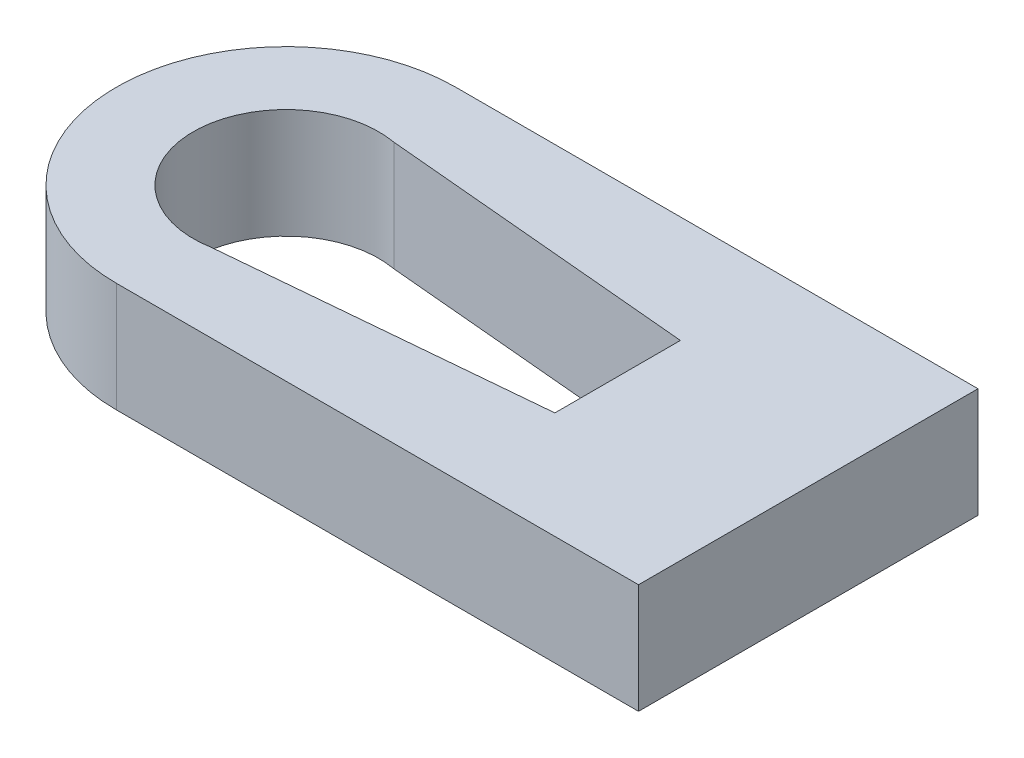
from build123d import *

# Parameters (mm, degrees)
BOSS_EXTRUDE1_START = 21.4
SKETCH1_R           = 6.5
BOSS_EXTRUDE1_DEPTH = 2.1
BOSS_EXTRUDE2_START = 21.4
SKETCH2_W           = 20
SKETCH2_H           = 13
BOSS_EXTRUDE2_DEPTH = 2.1
CUT_EXTRUDE1_START  = 21.4
SKETCH3_R           = 3.55
CUT_EXTRUDE1_DEPTH  = 2.1
CUT_EXTRUDE2_START  = 21.4
CUT_EXTRUDE2_DEPTH  = 2.1


with BuildPart() as part:
    # Sketch1 → Boss-Extrude1 (new, symmetric)
    with BuildSketch(Plane(origin=(0, 0, 0), x_dir=(1, 0, 0), z_dir=(0, 1, 0)).offset(BOSS_EXTRUDE1_START)):
        with Locations(Location((0, 0, 0), (0, 0, 270))):
            Circle(SKETCH1_R)
    extrude(amount=BOSS_EXTRUDE1_DEPTH, both=True)

    # Sketch2 → Boss-Extrude2 (add, symmetric)
    with BuildSketch(Plane(origin=(0, 0, 0), x_dir=(1, 0, 0), z_dir=(0, 1, 0)).offset(BOSS_EXTRUDE2_START)):
        with Locations((10, 0)):
            Rectangle(SKETCH2_W, SKETCH2_H)
    extrude(amount=BOSS_EXTRUDE2_DEPTH, both=True)

    # Sketch3 → Cut-Extrude1 (cut, symmetric)
    with BuildSketch(Plane(origin=(0, 0, 0), x_dir=(1, 0, 0), z_dir=(0, 1, 0)).offset(CUT_EXTRUDE1_START)):
        with Locations(Location((0, 0, 0), (0, 0, 270))):
            Circle(SKETCH3_R)
    extrude(amount=CUT_EXTRUDE1_DEPTH, both=True, mode=Mode.SUBTRACT)

    # Sketch4 → Cut-Extrude2 (cut, symmetric)
    with BuildSketch(Plane(origin=(0, 0, 0), x_dir=(1, 0, 0), z_dir=(0, 1, 0)).offset(CUT_EXTRUDE2_START)):
        Polygon((0, -3.55), (12.7, -2.403281405), (12.7, 2.403281405), (0, 3.55), align=None)
    extrude(amount=CUT_EXTRUDE2_DEPTH, both=True, mode=Mode.SUBTRACT)


solid = part.part
